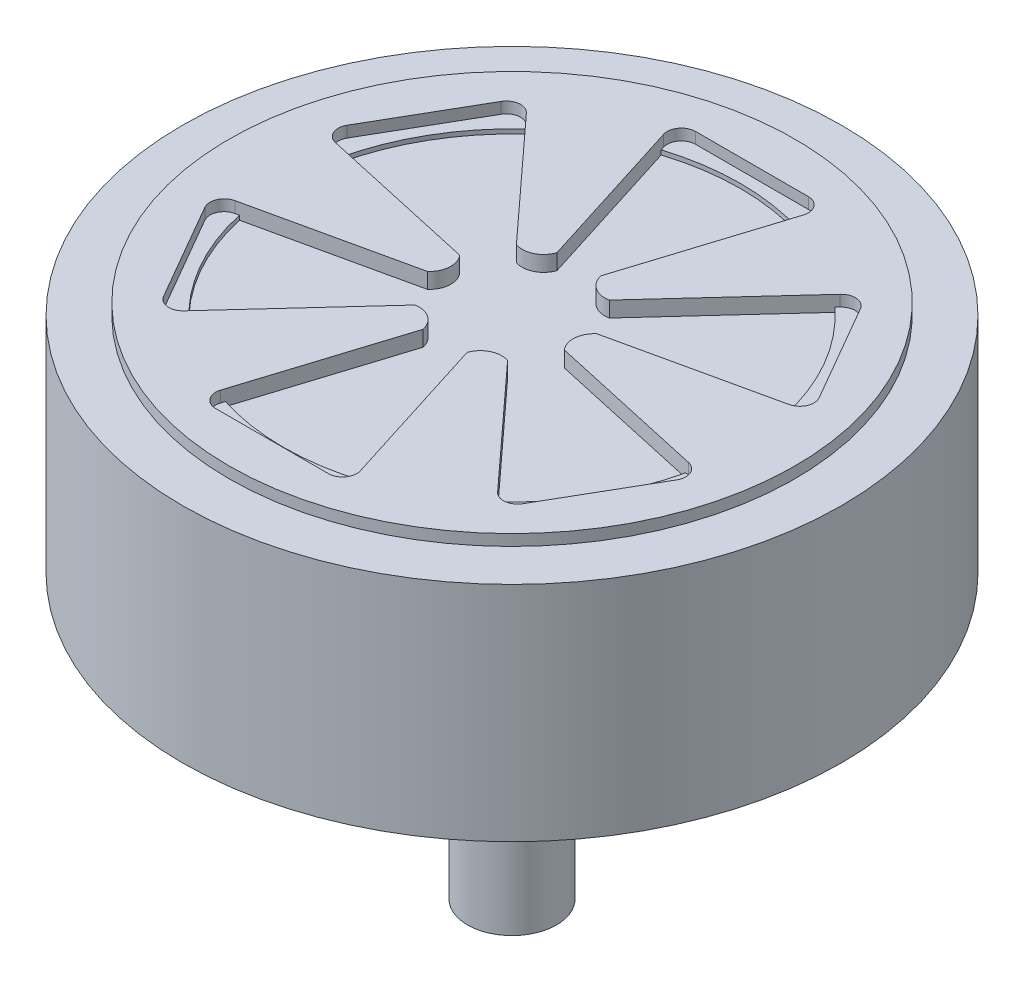
from build123d import *

# Parameters (mm, degrees)
SKETCH3_R           = 59.15
SKETCH3_R_2         = 38.25
BOSS_EXTRUDE1_DEPTH = 40
SKETCH4_R           = 41.021
CUT_EXTRUDE1_DEPTH  = 3.556
SKETCH5_R           = 50.8
BOSS_EXTRUDE2_DEPTH = 2
SKETCH7_R           = 44.45
BOSS_EXTRUDE3_DEPTH = 7.366
CUT_EXTRUDE2_DEPTH  = 2.794
BOSS_EXTRUDE5_DEPTH = 13.91
SKETCH11_R          = 41.021
BOSS_EXTRUDE6_DEPTH = 4.318
SKETCH12_R          = 8
BOSS_EXTRUDE7_DEPTH = 50


with BuildPart() as part:
    # Sketch3 → Boss-Extrude1 (new body)
    with BuildSketch(Plane(origin=(0, 0, 0), x_dir=(1, 0, 0), z_dir=(0, 1, 0))):
        with Locations(Location((0, 0, 0), (0, 0, 270))):
            Circle(SKETCH3_R)
        with Locations(Location((0, 0, 0), (0, 0, 270))):
            Circle(SKETCH3_R_2, mode=Mode.SUBTRACT)
    extrude(amount=BOSS_EXTRUDE1_DEPTH)

    # Sketch4 → Cut-Extrude1 (cut)
    with BuildSketch(Plane(origin=(0, 40, 0), x_dir=(1, 0, 0), z_dir=(0, 1, 0))):
        with Locations(Location((0, 0, 0), (0, 0, 270))):
            Circle(SKETCH4_R)
    cut_extrude1 = extrude(amount=-CUT_EXTRUDE1_DEPTH, mode=Mode.SUBTRACT)

    # Mirror1: Cut-Extrude1 across plane
    add(cut_extrude1.mirror(Plane.ZX.offset(20)), mode=Mode.SUBTRACT)



with BuildPart() as body_2:
    # Sketch5 → Boss-Extrude2 (new body)
    with BuildSketch(Plane(origin=(0, 40, 0), x_dir=(1, 0, 0), z_dir=(0, 1, 0))):
        with Locations(Location((0, 0, 0), (0, 0, 270))):
            Circle(SKETCH5_R)
    extrude(amount=BOSS_EXTRUDE2_DEPTH)

    # Sketch7 → Boss-Extrude3 (add)
    with BuildSketch(Plane(origin=(0, 42, 0), x_dir=(1, 0, 0), z_dir=(0, 1, 0))):
        with Locations(Location((0, 0, 0), (0, 0, 270))):
            Circle(SKETCH7_R)
    extrude(amount=-BOSS_EXTRUDE3_DEPTH)

    # Sketch8 → Cut-Extrude2 (cut)
    with BuildSketch(Plane(origin=(0, 42, 0), x_dir=(1, 0, 0), z_dir=(0, 1, 0))):
        with BuildLine():
            Line((-3.717986915, 11.786271444), (-12.545239758, 39.769263451))
            ThreePointArc((-12.545239758, 39.769263451), (-12.171377231, 42.035175802), (-10.12290422, 43.073390757))
            Line((-10.12290422, 43.073390757), (10.12290422, 43.073390757))
            ThreePointArc((10.12290422, 43.073390757), (12.171377231, 42.035175802), (12.545239758, 39.769263451))
            Line((12.545239758, 39.769263451), (3.832946747, 12.150701932))
            ThreePointArc((3.832946747, 12.150701932), (5.461454635, 9.696711292), (8.348217029, 9.113006841))
            Line((8.348217029, 9.113006841), (28.16857256, 30.749128053))
            ThreePointArc((28.16857256, 30.749128053), (30.317841482, 31.558309782), (32.241198512, 30.303387593))
            Line((32.241198512, 30.303387593), (42.364102732, 12.770003164))
            ThreePointArc((42.364102732, 12.770003164), (42.489218712, 10.47686602), (40.713812318, 9.020135398))
            Line((40.713812318, 9.020135398), (12.43928992, 2.755921712))
            ThreePointArc((12.43928992, 2.755921712), (11.12832563, 0.11859719), (12.066203944, -2.673264603))
            Line((12.066203944, -2.673264603), (40.713812318, -9.020135398))
            ThreePointArc((40.713812318, -9.020135398), (42.489218712, -10.47686602), (42.364102732, -12.770003164))
            Line((42.364102732, -12.770003164), (32.241198512, -30.303387593))
            ThreePointArc((32.241198512, -30.303387593), (30.317841482, -31.558309782), (28.16857256, -30.749128053))
            Line((28.16857256, -30.749128053), (8.606343173, -9.39478022))
            ThreePointArc((8.606343173, -9.39478022), (5.666870994, -9.578114102), (3.717986915, -11.786271444))
            Line((3.717986915, -11.786271444), (12.545239758, -39.769263451))
            ThreePointArc((12.545239758, -39.769263451), (12.171377231, -42.035175802), (10.12290422, -43.073390757))
            Line((10.12290422, -43.073390757), (-10.12290422, -43.073390757))
            ThreePointArc((-10.12290422, -43.073390757), (-12.171377231, -42.035175802), (-12.545239758, -39.769263451))
            Line((-12.545239758, -39.769263451), (-3.832946747, -12.150701932))
            ThreePointArc((-3.832946747, -12.150701932), (-5.461454635, -9.696711292), (-8.348217029, -9.113006841))
            Line((-8.348217029, -9.113006841), (-28.16857256, -30.749128053))
            ThreePointArc((-28.16857256, -30.749128053), (-30.317841482, -31.558309782), (-32.241198512, -30.303387593))
            Line((-32.241198512, -30.303387593), (-42.364102732, -12.770003164))
            ThreePointArc((-42.364102732, -12.770003164), (-42.489218712, -10.47686602), (-40.713812318, -9.020135398))
            Line((-40.713812318, -9.020135398), (-12.43928992, -2.755921712))
            ThreePointArc((-12.43928992, -2.755921712), (-11.12832563, -0.11859719), (-12.066203944, 2.673264603))
            Line((-12.066203944, 2.673264603), (-40.713812318, 9.020135398))
            ThreePointArc((-40.713812318, 9.020135398), (-42.489218712, 10.47686602), (-42.364102732, 12.770003164))
            Line((-42.364102732, 12.770003164), (-32.241198512, 30.303387593))
            ThreePointArc((-32.241198512, 30.303387593), (-30.317841482, 31.558309782), (-28.16857256, 30.749128053))
            Line((-28.16857256, 30.749128053), (-8.606343173, 9.39478022))
            ThreePointArc((-8.606343173, 9.39478022), (-5.666870994, 9.578114102), (-3.717986915, 11.786271444))
        make_face()
    extrude(amount=-CUT_EXTRUDE2_DEPTH, mode=Mode.SUBTRACT)


with BuildPart() as part_1:
    add(part.part)

    add(body_2.part)  # Boss-Extrude5 merges body 2
    # Sketch10 → Boss-Extrude5 (add)
    with BuildSketch(Plane(origin=(0, 39.206, 0), x_dir=(1, 0, 0), z_dir=(0, 1, 0))):
        with BuildLine():
            Line((10.12290422, 45.613390757), (-10.12290422, 45.613390757))
            ThreePointArc((-10.12290422, 45.613390757), (-14.219850242, 43.536960847), (-14.967575297, 39.005136146))
            Line((-14.967575297, 39.005136146), (-6.471688132, 12.072595881))
            ThreePointArc((-6.471688132, 12.072595881), (-6.854928199, 11.827206148), (-7.29904471, 11.727961017))
            Line((-7.29904471, 11.727961017), (-26.295651132, 32.464868513))
            ThreePointArc((-26.295651132, 32.464868513), (-30.594188976, 34.083231971), (-34.440903038, 31.573387593))
            Line((-34.440903038, 31.573387593), (-44.563807258, 14.040003164))
            ThreePointArc((-44.563807258, 14.040003164), (-44.814039218, 9.453728876), (-41.263226429, 6.540267633))
            Line((-41.263226429, 6.540267633), (-13.691018788, 0.431651613))
            ThreePointArc((-13.691018788, 0.431651613), (-13.67012508, -0.022938888), (-13.80623453, -0.457177633))
            Line((-13.80623453, -0.457177633), (-41.263226429, -6.540267633))
            ThreePointArc((-41.263226429, -6.540267633), (-44.814039218, -9.453728876), (-44.563807258, -14.040003164))
            Line((-44.563807258, -14.040003164), (-34.440903038, -31.573387593))
            ThreePointArc((-34.440903038, -31.573387593), (-30.594188976, -34.083231971), (-26.295651132, -32.464868513))
            Line((-26.295651132, -32.464868513), (-7.219330657, -11.640944268))
            ThreePointArc((-7.219330657, -11.640944268), (-6.81519688, -11.850145036), (-6.507189821, -12.185138651))
            Line((-6.507189821, -12.185138651), (-14.967575297, -39.005136146))
            ThreePointArc((-14.967575297, -39.005136146), (-14.219850242, -43.536960847), (-10.12290422, -45.613390757))
            Line((-10.12290422, -45.613390757), (10.12290422, -45.613390757))
            ThreePointArc((10.12290422, -45.613390757), (14.219850242, -43.536960847), (14.967575297, -39.005136146))
            Line((14.967575297, -39.005136146), (6.471688132, -12.072595881))
            ThreePointArc((6.471688132, -12.072595881), (6.854928199, -11.827206148), (7.29904471, -11.727961017))
            Line((7.29904471, -11.727961017), (26.295651132, -32.464868513))
            ThreePointArc((26.295651132, -32.464868513), (30.594188976, -34.083231971), (34.440903038, -31.573387593))
            Line((34.440903038, -31.573387593), (44.563807258, -14.040003164))
            ThreePointArc((44.563807258, -14.040003164), (44.814039218, -9.453728876), (41.263226429, -6.540267633))
            Line((41.263226429, -6.540267633), (13.691018788, -0.431651613))
            ThreePointArc((13.691018788, -0.431651613), (13.67012508, 0.022938888), (13.80623453, 0.457177633))
            Line((13.80623453, 0.457177633), (41.263226429, 6.540267633))
            ThreePointArc((41.263226429, 6.540267633), (44.814039218, 9.453728876), (44.563807258, 14.040003164))
            Line((44.563807258, 14.040003164), (34.440903038, 31.573387593))
            ThreePointArc((34.440903038, 31.573387593), (30.594188976, 34.083231971), (26.295651132, 32.464868513))
            Line((26.295651132, 32.464868513), (7.219330657, 11.640944268))
            ThreePointArc((7.219330657, 11.640944268), (6.81519688, 11.850145036), (6.507189821, 12.185138651))
            Line((6.507189821, 12.185138651), (14.967575297, 39.005136146))
            ThreePointArc((14.967575297, 39.005136146), (14.219850242, 43.536960847), (10.12290422, 45.613390757))
        make_face()
    extrude(amount=-BOSS_EXTRUDE5_DEPTH)

    # Sketch11 → Boss-Extrude6 (add)
    with BuildSketch(Plane.XZ.offset(-3.556)):
        with Locations(Location((0, 0, 0), (0, 0, 90))):
            Circle(SKETCH11_R)
    extrude(amount=BOSS_EXTRUDE6_DEPTH)

    # Sketch12 → Boss-Extrude7 (add)
    with BuildSketch(Plane.XZ.offset(0.762)):
        with Locations(Location((0, 0, 0), (0, 0, 270))):
            Circle(SKETCH12_R)
    extrude(amount=BOSS_EXTRUDE7_DEPTH)


solid = part_1.part
